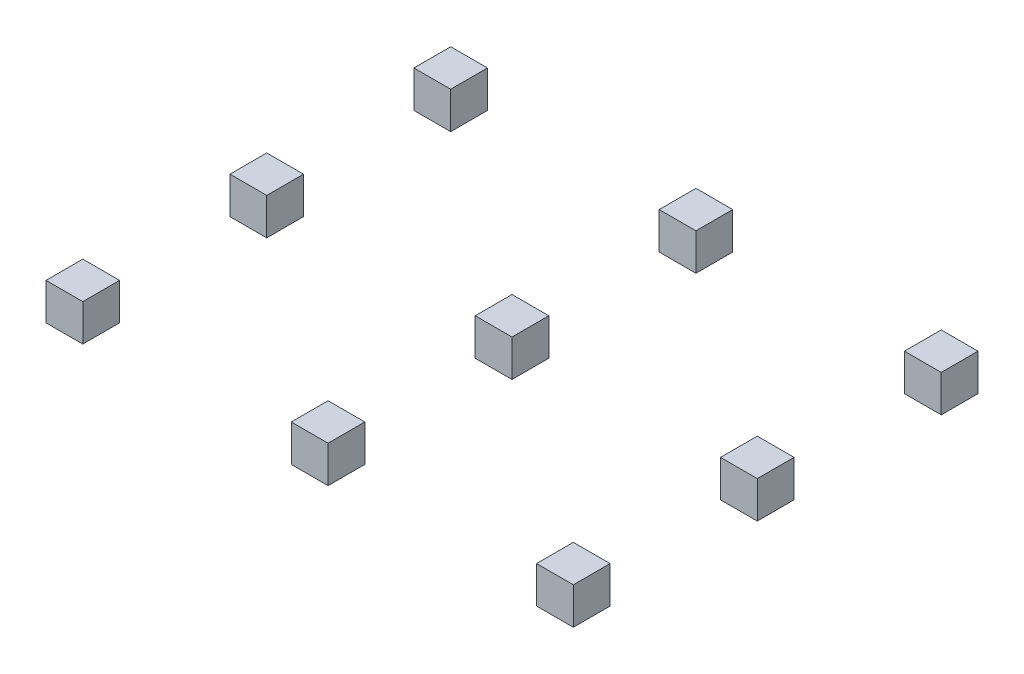
from build123d import *

# Parameters (mm, degrees)
SKETCH_1_W        = 300
SKETCH_1_H        = 300
EXTRUDE_1_DEPTH   = 300
EXTRUDE_1_2_DEPTH = 300
EXTRUDE_1_3_DEPTH = 300
EXTRUDE_1_4_DEPTH = 300
EXTRUDE_1_5_DEPTH = 300
EXTRUDE_1_6_DEPTH = 300
EXTRUDE_1_7_DEPTH = 300
EXTRUDE_1_8_DEPTH = 300
EXTRUDE_1_9_DEPTH = 300


with BuildPart() as part:
    # Эскиз1 → Бобышка-Вытянуть1 (new body)
    with BuildSketch(Plane(origin=(0, 0, 0), x_dir=(1, 0, 0), z_dir=(0, 1, 0))):
        with Locations((0, -1500)):
            Rectangle(SKETCH_1_W, SKETCH_1_H)
    extrude(amount=EXTRUDE_1_DEPTH)


with BuildPart() as body_2:
    # Эскиз1 → Extrude 1 2 (new body)
    with BuildSketch(Plane(origin=(0, 0, 0), x_dir=(1, 0, 0), z_dir=(0, 1, 0))):
        with Locations((-2000, -1500)):
            Rectangle(SKETCH_1_W, SKETCH_1_H)
    extrude(amount=EXTRUDE_1_2_DEPTH)


with BuildPart() as body_3:
    # Эскиз1 → Extrude 1 3 (new body)
    with BuildSketch(Plane(origin=(0, 0, 0), x_dir=(1, 0, 0), z_dir=(0, 1, 0))):
        with Locations((2000, -1500)):
            Rectangle(SKETCH_1_W, SKETCH_1_H)
    extrude(amount=EXTRUDE_1_3_DEPTH)


with BuildPart() as body_4:
    # Эскиз1 → Extrude 1 4 (new body)
    with BuildSketch(Plane(origin=(0, 0, 0), x_dir=(1, 0, 0), z_dir=(0, 1, 0))):
        Rectangle(SKETCH_1_W, SKETCH_1_H)
    extrude(amount=EXTRUDE_1_4_DEPTH)


with BuildPart() as body_5:
    # Эскиз1 → Extrude 1 5 (new body)
    with BuildSketch(Plane(origin=(0, 0, 0), x_dir=(1, 0, 0), z_dir=(0, 1, 0))):
        with Locations((2000, 0)):
            Rectangle(SKETCH_1_W, SKETCH_1_H)
    extrude(amount=EXTRUDE_1_5_DEPTH)


with BuildPart() as body_6:
    # Эскиз1 → Extrude 1 6 (new body)
    with BuildSketch(Plane(origin=(0, 0, 0), x_dir=(1, 0, 0), z_dir=(0, 1, 0))):
        with Locations((0, 1500)):
            Rectangle(SKETCH_1_W, SKETCH_1_H)
    extrude(amount=EXTRUDE_1_6_DEPTH)


with BuildPart() as body_7:
    # Эскиз1 → Extrude 1 7 (new body)
    with BuildSketch(Plane(origin=(0, 0, 0), x_dir=(1, 0, 0), z_dir=(0, 1, 0))):
        with Locations((2000, 1500)):
            Rectangle(SKETCH_1_W, SKETCH_1_H)
    extrude(amount=EXTRUDE_1_7_DEPTH)


with BuildPart() as body_8:
    # Эскиз1 → Extrude 1 8 (new body)
    with BuildSketch(Plane(origin=(0, 0, 0), x_dir=(1, 0, 0), z_dir=(0, 1, 0))):
        with Locations((-2000, 0)):
            Rectangle(SKETCH_1_W, SKETCH_1_H)
    extrude(amount=EXTRUDE_1_8_DEPTH)


with BuildPart() as body_9:
    # Эскиз1 → Extrude 1 9 (new body)
    with BuildSketch(Plane(origin=(0, 0, 0), x_dir=(1, 0, 0), z_dir=(0, 1, 0))):
        with Locations((-2000, 1500)):
            Rectangle(SKETCH_1_W, SKETCH_1_H)
    extrude(amount=EXTRUDE_1_9_DEPTH)


solid = Compound([part.part, body_2.part, body_3.part, body_4.part, body_5.part, body_6.part, body_7.part, body_8.part, body_9.part])
